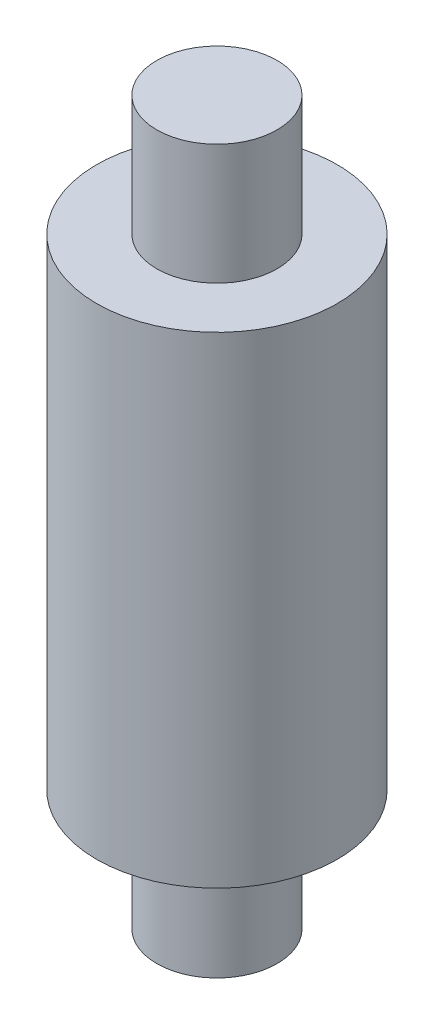
from build123d import *

# Parameters (mm, degrees)
SKETCH_1_R      = 1
EXTRUDE_1_DEPTH = 2
SKETCH_2_R      = 2
EXTRUDE_2_DEPTH = 8
SKETCH_3_R      = 1
EXTRUDE_3_DEPTH = 2


with BuildPart() as part:
    # 草图1 → 凸台-拉伸1 (new body)
    with BuildSketch(Plane(origin=(0, 0, 0), x_dir=(1, 0, 0), z_dir=(0, 1, 0))):
        with Locations(Location((0, 0, 0), (0, 0, 270))):
            Circle(SKETCH_1_R)
    extrude(amount=EXTRUDE_1_DEPTH)

    # 草图2 → 凸台-拉伸2 (add)
    with BuildSketch(Plane(origin=(0, 2, 0), x_dir=(1, 0, 0), z_dir=(0, 1, 0))):
        with Locations(Location((0, 0, 0), (0, 0, 270))):
            Circle(SKETCH_2_R)
    extrude(amount=EXTRUDE_2_DEPTH)

    # 草图3 → 凸台-拉伸3 (add)
    with BuildSketch(Plane(origin=(0, 10, 0), x_dir=(1, 0, 0), z_dir=(0, 1, 0))):
        with Locations(Location((0, 0, 0), (0, 0, 270))):
            Circle(SKETCH_3_R)
    extrude(amount=EXTRUDE_3_DEPTH)


solid = part.part
